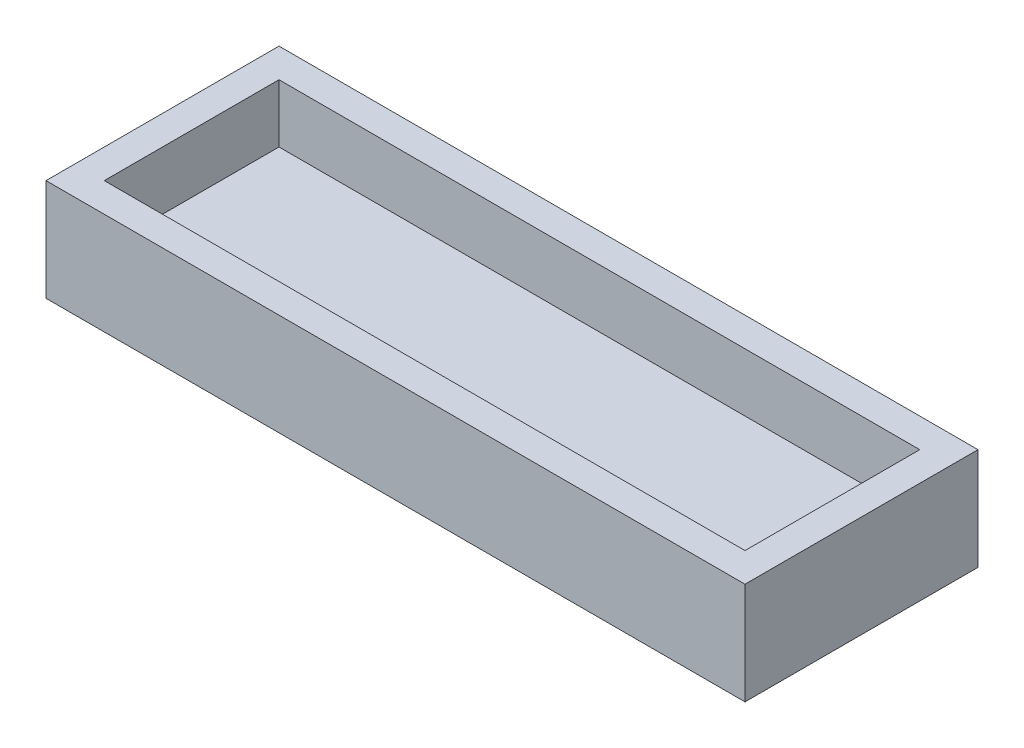
from build123d import *

# Parameters (mm, degrees)
SKETCH1_W           = 44
SKETCH1_H           = 12
BOSS_EXTRUDE1_DEPTH = 3
SKETCH2_W           = 48
SKETCH2_H           = 16
SKETCH2_W_2         = 44
SKETCH2_H_2         = 12
BOSS_EXTRUDE2_DEPTH = 7


with BuildPart() as part:
    # Sketch1 → Boss-Extrude1 (new body)
    with BuildSketch(Plane(origin=(0, 0, 0), x_dir=(1, 0, 0), z_dir=(0, 1, 0))):
        Rectangle(SKETCH1_W, SKETCH1_H)
    extrude(amount=BOSS_EXTRUDE1_DEPTH)

    # Sketch2 → Boss-Extrude2 (add)
    with BuildSketch(Plane.XZ):
        Rectangle(SKETCH2_W, SKETCH2_H)
        Rectangle(SKETCH2_W_2, SKETCH2_H_2, mode=Mode.SUBTRACT)
    extrude(amount=-BOSS_EXTRUDE2_DEPTH)


solid = part.part
